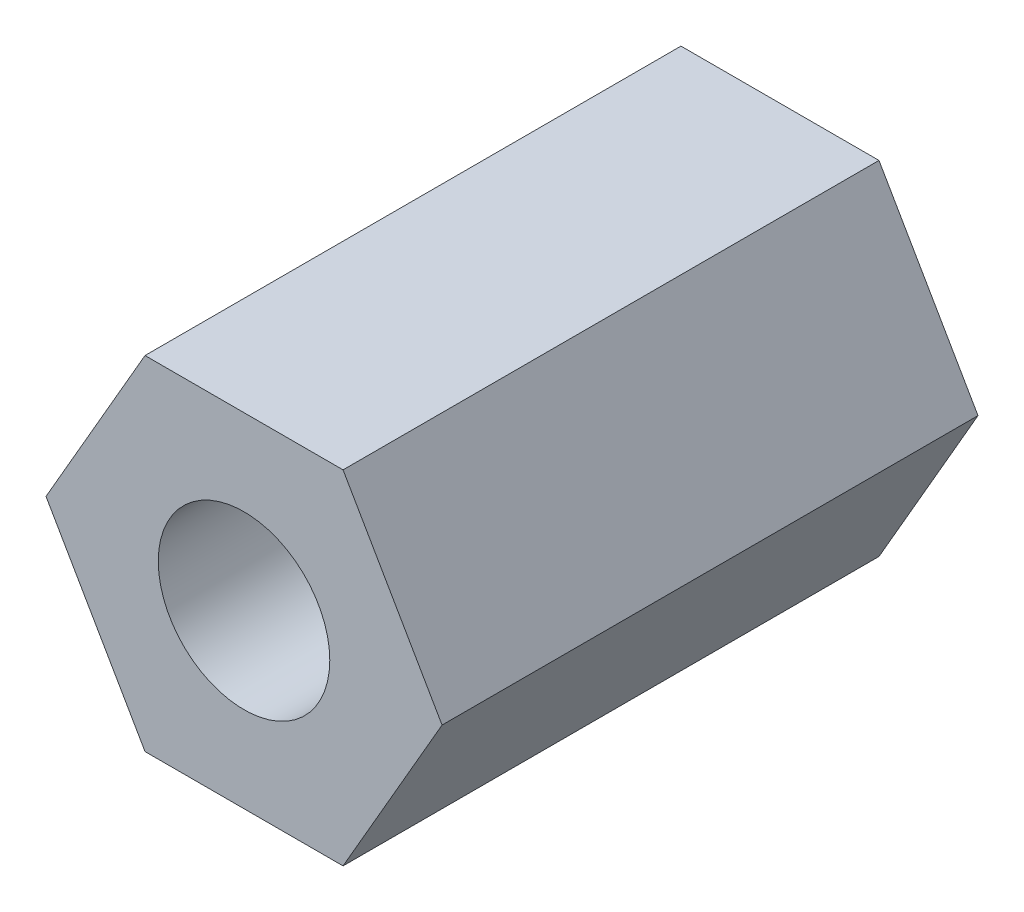
from build123d import *

# Parameters (mm, degrees)
EXTRUDE_1_DEPTH        = 5
HOLE_WIZARD_M2_1_D     = 1.6
HOLE_WIZARD_M2_1_DEPTH = 6
HOLE_WIZARD_M2_1_TIP   = 0.480688495


with BuildPart() as part:
    # 草图1 → 拉伸1 (new body)
    with BuildSketch(Plane.XY):
        Polygon((0.923760431, -1.6), (1.847520861, 0), (0.923760431, 1.6), (-0.923760431, 1.6), (-1.847520861, 0), (-0.923760431, -1.6), align=None)
    extrude(amount=EXTRUDE_1_DEPTH)

    # M2 螺纹孔1
    with Locations(Plane(origin=(0, 0, 0), x_dir=(-1, 0, 0), z_dir=(0, 0, -1))):
        with Locations((0, 0)):
            Hole(HOLE_WIZARD_M2_1_D / 2, depth=HOLE_WIZARD_M2_1_DEPTH)
            with Locations((0, 0, -(HOLE_WIZARD_M2_1_DEPTH + HOLE_WIZARD_M2_1_TIP / 2))):  # 118° drill point
                Cone(0, HOLE_WIZARD_M2_1_D / 2, HOLE_WIZARD_M2_1_TIP, mode=Mode.SUBTRACT)


solid = part.part
